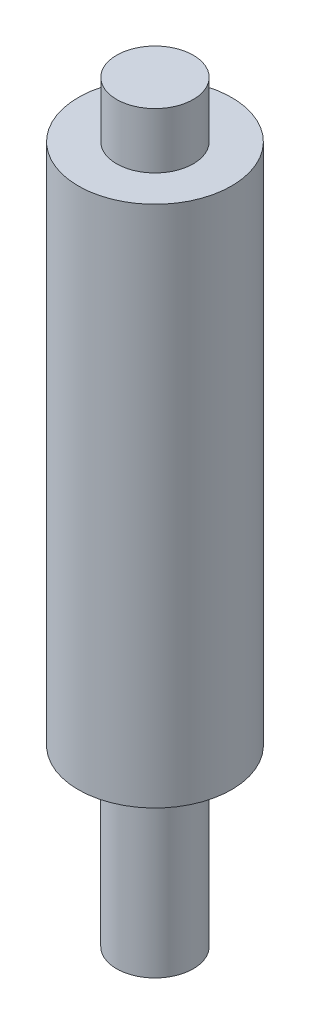
from build123d import *

# Parameters (mm, degrees)
SKETCH1_R           = 2.2
BOSS_EXTRUDE1_DEPTH = 15
SKETCH2_R           = 1.1
BOSS_EXTRUDE2_DEPTH = 1.6
BOSS_EXTRUDE3_START = 5
SKETCH3_R           = 1.1
BOSS_EXTRUDE3_DEPTH = 5


with BuildPart() as part:
    # Sketch1 → Boss-Extrude1 (new body)
    with BuildSketch(Plane(origin=(0, 0, 0), x_dir=(1, 0, 0), z_dir=(0, 1, 0))):
        with Locations(Location((0, 0, 0), (0, 0, 270))):
            Circle(SKETCH1_R)
    extrude(amount=BOSS_EXTRUDE1_DEPTH)

    # Sketch2 → Boss-Extrude2 (add)
    with BuildSketch(Plane(origin=(0, 15, 0), x_dir=(1, 0, 0), z_dir=(0, 1, 0))):
        with Locations(Location((0, 0, 0), (0, 0, 270))):
            Circle(SKETCH2_R)
    extrude(amount=BOSS_EXTRUDE2_DEPTH)

    # Sketch3 → Boss-Extrude3 (add)
    with BuildSketch(Plane.XZ.offset(BOSS_EXTRUDE3_START)):
        with Locations(Location((0, 0, 0), (0, 0, 90))):
            Circle(SKETCH3_R)
    extrude(amount=-BOSS_EXTRUDE3_DEPTH)


solid = part.part
